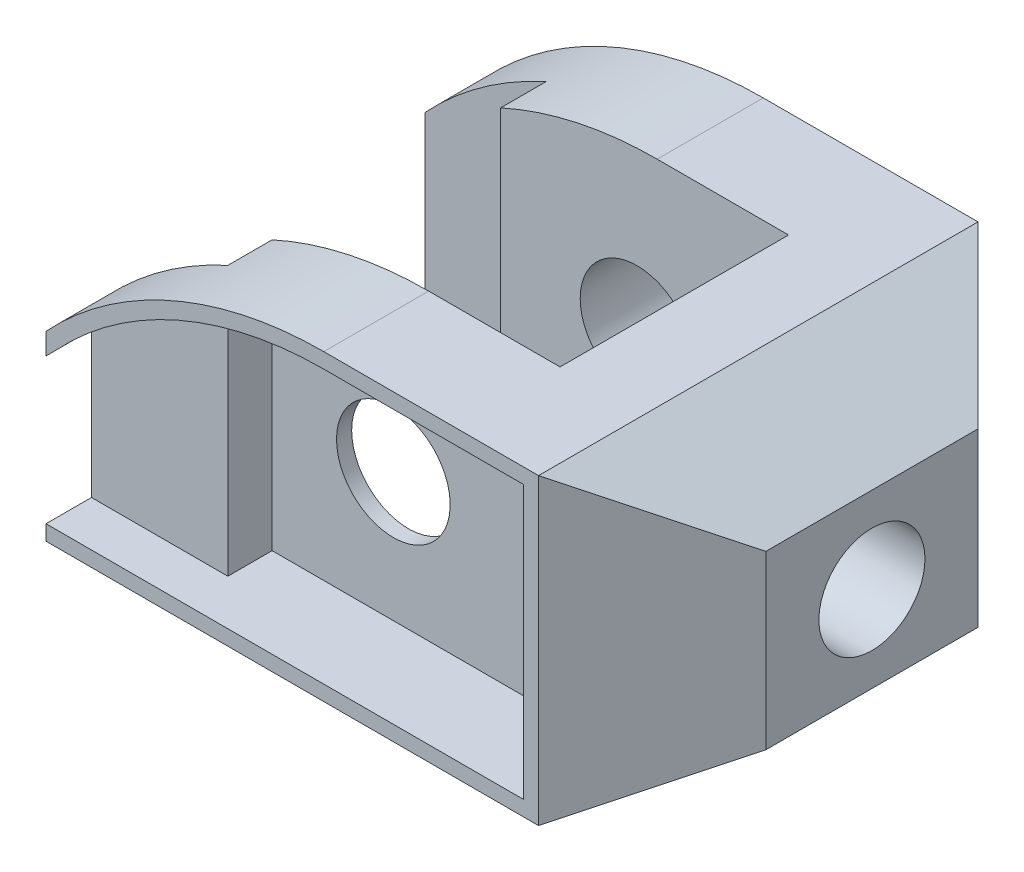
from build123d import *

# Parameters (mm, degrees)
ESQUISSE1_R              = 7.5
BOSS_EXTRU_1_DEPTH       = 58
ENL_V_MAT_EXTRU_2_DEPTH  = 107.60206377
ESQUISSE5_R              = 7
ENL_V_MAT_EXTRU_3_DEPTH  = 107.60206377
ESQUISSE11_W             = 42
ESQUISSE11_H             = 40
ENL_V_MAT_EXTRU_50_DEPTH = 16
ESQUISSE12_W             = 30.159824364
ESQUISSE12_H             = 40
ENL_V_MAT_EXTRU_51_DEPTH = 38
ENL_V_START              = -6
ESQUISSE13_R             = 7.5
ENL_V_MAT_EXTRU_52_DEPTH = 6
ENL_V_START_2            = -5.840175636
ENL_V_MAT_EXTRU_53_DEPTH = 5.840175636


with BuildPart() as part:
    # Esquisse1 → Boss.-Extru.1 (new body)
    with BuildSketch(Plane.XY):
        with BuildLine():
            Line((0, 0), (0, 24))
            Line((0, 24), (0.042431239, 24.04563747))
            ThreePointArc((0.042431239, 24.04563747), (16.689202308, 35.8382039), (36.660658521, 40))
            Line((36.660658521, 40), (65, 40))
            Line((65, 40), (80, 31.339745962))
            Line((80, 31.339745962), (80, 8.660254038))
            Line((80, 8.660254038), (65, 0))
            Line((65, 0), (0, 0))
        make_face()
        with Locations(Location((34, 19, 0), (0, 0, 180))):
            Circle(ESQUISSE1_R, mode=Mode.SUBTRACT)
    extrude(amount=BOSS_EXTRU_1_DEPTH)

    # Esquisse4 → Enlèv. mat.-Extru.2 (cut, through all)
    with BuildSketch(Plane.XZ):
        Polygon((65, 58), (80, 43), (80, 58), align=None)
        Polygon((65, 0), (80, 0), (80, 15), align=None)
    extrude(amount=-ENL_V_MAT_EXTRU_2_DEPTH, mode=Mode.SUBTRACT)

    # Esquisse5 → Enlèv. mat.-Extru.3 (cut, through all)
    with BuildSketch(Plane(origin=(80, 0, 0), x_dir=(0, 0, -1), z_dir=(1, 0, 0))):
        with Locations((-29, 20)):
            Circle(ESQUISSE5_R)
    extrude(amount=-ENL_V_MAT_EXTRU_3_DEPTH, mode=Mode.SUBTRACT)

    # Esquisse11 → Enlèv. mat.-Extru.50 (cut)
    with BuildSketch(Plane.ZY):
        with Locations((29, 20)):
            Rectangle(ESQUISSE11_W, ESQUISSE11_H)
    extrude(amount=-ENL_V_MAT_EXTRU_50_DEPTH, mode=Mode.SUBTRACT)

    # Esquisse12 → Enlèv. mat.-Extru.51 (cut)
    with BuildSketch(Plane.ZY.offset(-16)):
        with Locations((29.079912182, 20)):
            Rectangle(ESQUISSE12_W, ESQUISSE12_H)
    extrude(amount=-ENL_V_MAT_EXTRU_51_DEPTH, mode=Mode.SUBTRACT)

    # Esquisse13 → Enlèv. mat.-Extru.52 (cut)
    with BuildSketch(Plane.XY.offset(58).offset(ENL_V_START)):
        with BuildLine():
            Line((0, 21.176651641), (0, 2))
            Line((0, 2), (63, 2))
            Line((63, 2), (63, 38))
            Line((63, 38), (36.660658521, 38))
            ThreePointArc((36.660658521, 38), (17.488060557, 34.004675744), (1.507160331, 22.683811971))
            Line((1.507160331, 22.683811971), (0, 21.176651641))
        make_face()
        with Locations(Location((34, 19, 0), (0, 0, 180))):
            Circle(ESQUISSE13_R, mode=Mode.SUBTRACT)
    extrude(amount=ENL_V_MAT_EXTRU_52_DEPTH, mode=Mode.SUBTRACT)

    # Esquisse14 → Enlèv. mat.-Extru.53 (cut)
    with BuildSketch(Plane.XY.offset(52).offset(ENL_V_START_2)):
        with BuildLine():
            Line((63, 38), (63, 2))
            Line((63, 2), (18, 2))
            Line((18, 2), (18, 34.224199524))
            ThreePointArc((18, 34.224199524), (27.141246175, 37.046581051), (36.660658521, 38))
            Line((36.660658521, 38), (63, 38))
        make_face()
    extrude(amount=ENL_V_MAT_EXTRU_53_DEPTH, mode=Mode.SUBTRACT)


solid = part.part
